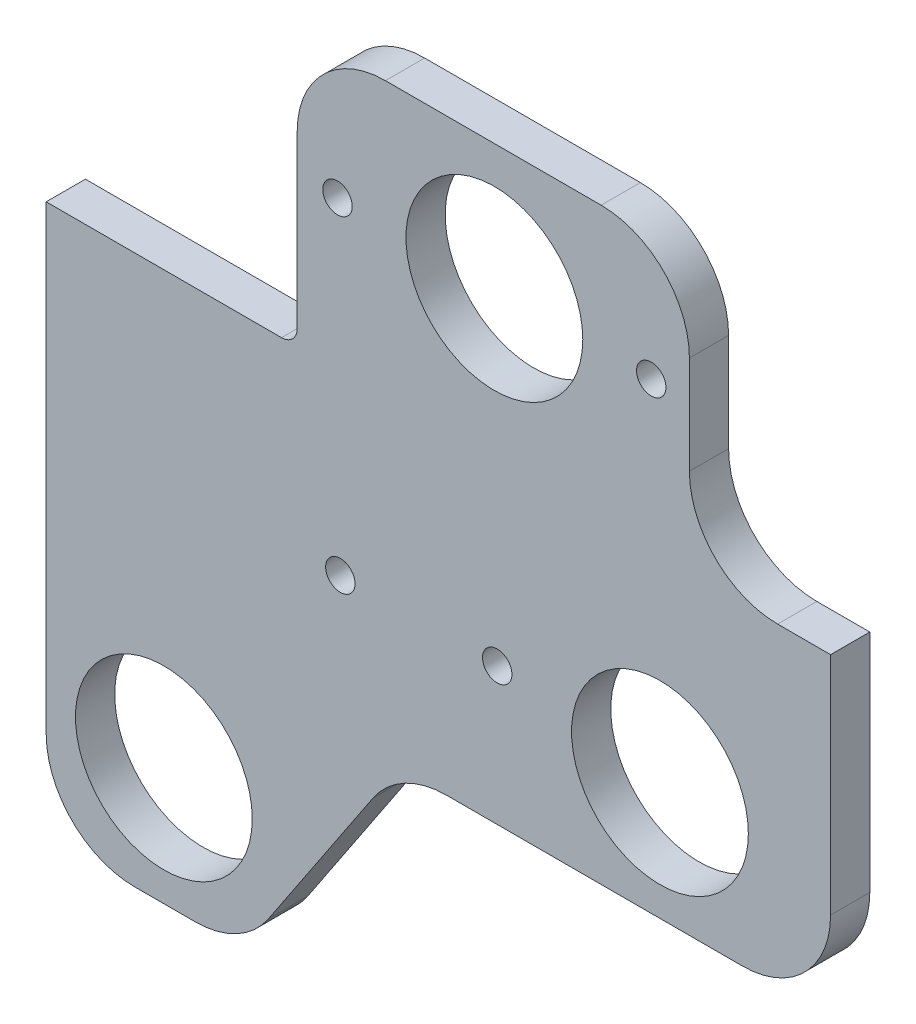
from build123d import *

# Parameters (mm, degrees)
SKETCH1_R           = 14.3129
BOSS_EXTRUDE1_DEPTH = 6.35
FILLET1_R           = 14.2875
SKETCH2_W           = 63.5
SKETCH2_H           = 44.45
BOSS_EXTRUDE2_DEPTH = 6.35
FILLET2_R           = 14.2875
SKETCH3_R           = 14.3129
CUT_EXTRUDE1_DEPTH  = 110.433918417
SKETCH4_R           = 2.38125
SKETCH4_R_2         = 14.2875
CUT_EXTRUDE2_DEPTH  = 110.433918417
SKETCH5_R           = 2.38125
CUT_EXTRUDE3_DEPTH  = 110.433918417
FILLET3_R           = 2.54


with BuildPart() as part:
    # Sketch1 → Boss-Extrude1 (new body)
    with BuildSketch(Plane.XY):
        Polygon((-6.35, -6.35), (63.5, -6.35), (63.5, 44.45), (-63.5, 44.45), (-63.5, -44.45), (-31.75, -44.45), align=None)
        with Locations((-44.45, -25.4)):
            Circle(SKETCH1_R, mode=Mode.SUBTRACT)
        with Locations((35.871852568, 12.7)):
            Circle(SKETCH1_R, mode=Mode.SUBTRACT)
    extrude(amount=BOSS_EXTRUDE1_DEPTH)

    # Fillet1
    fillet1_edges = [part.edges().sort_by_distance(p)[0] for p in [
        (-31.75, -44.45, 3.175),
        (-63.5, -44.45, 3.175),
        (63.5, -6.35, 3.175),
        (-6.35, -6.35, 3.175),
    ]]
    fillet(fillet1_edges, radius=FILLET1_R)

    # Sketch2 → Boss-Extrude2 (add)
    with BuildSketch(Plane.XY.offset(6.35)):
        with Locations((8.89, 66.675)):
            Rectangle(SKETCH2_W, SKETCH2_H)
    extrude(amount=-BOSS_EXTRUDE2_DEPTH)

    # Fillet2
    fillet2_edges = [part.edges().sort_by_distance(p)[0] for p in [
        (-22.86, 88.9, 3.175),
        (40.64, 88.9, 3.175),
        (40.64, 44.45, 3.175),
    ]]
    fillet(fillet2_edges, radius=FILLET2_R)

    # Sketch3 → Cut-Extrude1 (cut, through all)
    with BuildSketch(Plane.XY.offset(6.35)):
        with Locations((9.062967637, 68.577618639)):
            Circle(SKETCH3_R)
    extrude(amount=-CUT_EXTRUDE1_DEPTH, mode=Mode.SUBTRACT)

    # Sketch4 → Cut-Extrude2 (cut, through all)
    with BuildSketch(Plane.XY.offset(6.35)):
        with Locations((-16.337032363, 68.577618639)):
            Circle(SKETCH4_R)
        with Locations((34.462967637, 68.577618639)):
            Circle(SKETCH4_R)
        with Locations((9.062967637, 68.577618639)):
            Circle(SKETCH4_R_2)
    extrude(amount=-CUT_EXTRUDE2_DEPTH, mode=Mode.SUBTRACT)

    # Sketch5 → Cut-Extrude3 (cut, through all)
    with BuildSketch(Plane.XY.offset(6.35)):
        with Locations((-15.875, 15.875)):
            Circle(SKETCH5_R)
        with Locations((9.525, 15.875)):
            Circle(SKETCH5_R)
    extrude(amount=-CUT_EXTRUDE3_DEPTH, mode=Mode.SUBTRACT)

    # Fillet3
    fillet3_edges = [part.edges().sort_by_distance(p)[0] for p in [
        (-22.86, 44.45, 3.175),
    ]]
    fillet(fillet3_edges, radius=FILLET3_R)


solid = part.part
